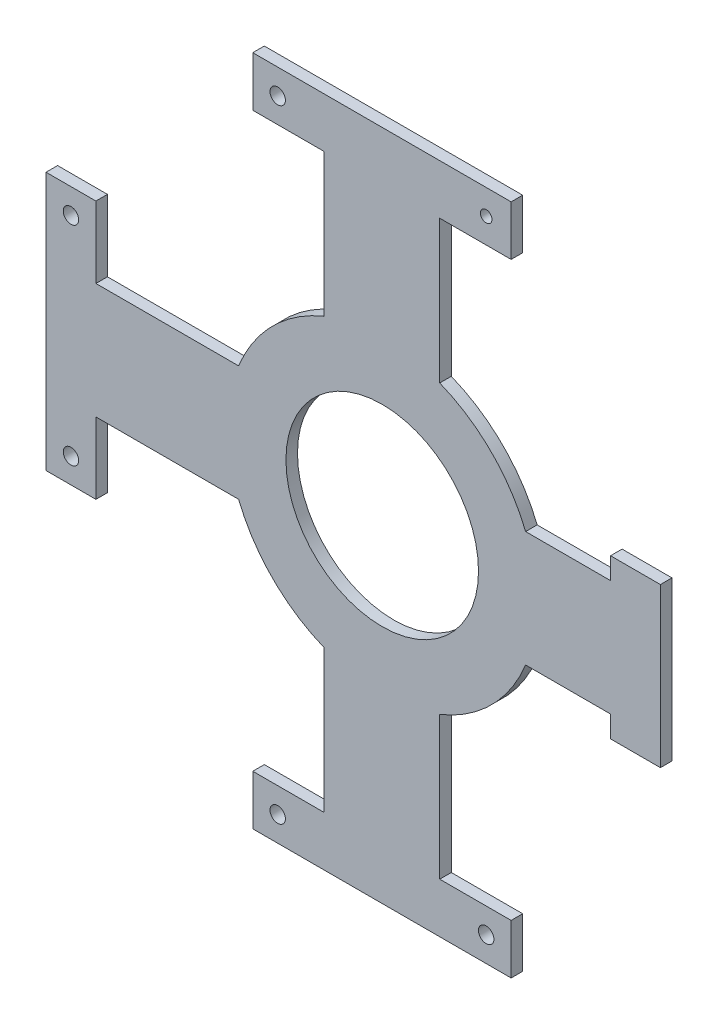
from build123d import *

# Parameters (mm, degrees)
CROQUIS1_R              = 25
SALIENTE_EXTRUIR1_DEPTH = 3
CROQUIS2_W              = 12.95
CROQUIS2_H              = 12.95
SALIENTE_EXTRUIR2_DEPTH = 3
CROQUIS3_R              = 1.5
CROQUIS3_R_2            = 2
CORTAR_EXTRUIR1_DEPTH   = 124.455998815


with BuildPart() as part:
    # Croquis1 → Saliente-Extruir1 (new body)
    with BuildSketch(Plane.XY):
        with BuildLine():
            Line((-15.070986718, 74.306476298), (-15.070986718, 37.256476298))
            ThreePointArc((-15.070986718, 37.256476298), (-28.445175059, 28.391049341), (-37.285113206, 15))
            Line((-37.285113206, 15), (-74.335113206, 15))
            Line((-74.335113206, 15), (-74.335113206, 20.59))
            Line((-74.335113206, 20.59), (-87.285113206, 20.59))
            Line((-87.285113206, 20.59), (-87.285113206, -20.59))
            Line((-87.285113206, -20.59), (-74.335113206, -20.59))
            Line((-74.335113206, -20.59), (-74.335113206, -15))
            Line((-74.335113206, -15), (-37.285113206, -15))
            ThreePointArc((-37.285113206, -15), (-28.445175059, -28.391049341), (-15.070986718, -37.256476298))
            Line((-15.070986718, -37.256476298), (-15.070986718, -74.306476298))
            Line((-15.070986718, -74.306476298), (-20.660986718, -74.306476298))
            Line((-20.660986718, -74.306476298), (-20.660986718, -87.256476298))
            Line((-20.660986718, -87.256476298), (20.519013282, -87.256476298))
            Line((20.519013282, -87.256476298), (20.519013282, -74.306476298))
            Line((20.519013282, -74.306476298), (14.929013282, -74.306476298))
            Line((14.929013282, -74.306476298), (14.929013282, -37.256476298))
            ThreePointArc((14.929013282, -37.256476298), (28.353570497, -28.407666286), (37.22795272, -15))
            Line((37.22795272, -15), (59.27795272, -15))
            Line((59.27795272, -15), (59.27795272, -20.59))
            Line((59.27795272, -20.59), (72.22795272, -20.59))
            Line((72.22795272, -20.59), (72.22795272, 20.59))
            Line((72.22795272, 20.59), (59.27795272, 20.59))
            Line((59.27795272, 20.59), (59.27795272, 15))
            Line((59.27795272, 15), (37.22795272, 15))
            ThreePointArc((37.22795272, 15), (28.353570497, 28.407666286), (14.929013282, 37.256476298))
            Line((14.929013282, 37.256476298), (14.929013282, 74.306476298))
            Line((14.929013282, 74.306476298), (20.519013282, 74.306476298))
            Line((20.519013282, 74.306476298), (20.519013282, 87.256476298))
            Line((20.519013282, 87.256476298), (-20.660986718, 87.256476298))
            Line((-20.660986718, 87.256476298), (-20.660986718, 74.306476298))
            Line((-20.660986718, 74.306476298), (-15.070986718, 74.306476298))
        make_face()
        Circle(CROQUIS1_R, mode=Mode.SUBTRACT)
    extrude(amount=SALIENTE_EXTRUIR1_DEPTH)

    # Croquis2 → Saliente-Extruir2 (add)
    with BuildSketch(Plane(origin=(0, 0, 0), x_dir=(-1, 0, 0), z_dir=(0, 0, -1))):
        with Locations((-26.994013282, 80.781476298)):
            Rectangle(CROQUIS2_W, CROQUIS2_H)
        with Locations((27.135986718, 80.781476298)):
            Rectangle(CROQUIS2_W, CROQUIS2_H)
        with Locations((-26.994013282, -80.781476298)):
            Rectangle(CROQUIS2_W, CROQUIS2_H)
        with Locations((27.135986718, -80.781476298)):
            Rectangle(CROQUIS2_W, CROQUIS2_H)
        with Locations((80.810113206, 27.065)):
            Rectangle(CROQUIS2_W, CROQUIS2_H)
        with Locations((80.810113206, -27.065)):
            Rectangle(CROQUIS2_W, CROQUIS2_H)
    extrude(amount=-SALIENTE_EXTRUIR2_DEPTH)

    # Croquis3 → Cortar-Extruir1 (cut, through all)
    with BuildSketch(Plane(origin=(0, 0, 0), x_dir=(-1, 0, 0), z_dir=(0, 0, -1))):
        with Locations((-26.994013282, 80.781476298)):
            Circle(CROQUIS3_R)
        with Locations((27.135986718, 80.781476298)):
            Circle(CROQUIS3_R_2)
        with Locations((27.135986718, -80.781476298)):
            Circle(CROQUIS3_R_2)
        with Locations((-26.994013282, -80.781476298)):
            Circle(CROQUIS3_R_2)
        with Locations((80.810113206, -27.065)):
            Circle(CROQUIS3_R_2)
        with Locations((80.810113206, 27.065)):
            Circle(CROQUIS3_R_2)
    extrude(amount=-CORTAR_EXTRUIR1_DEPTH, mode=Mode.SUBTRACT)


solid = part.part
